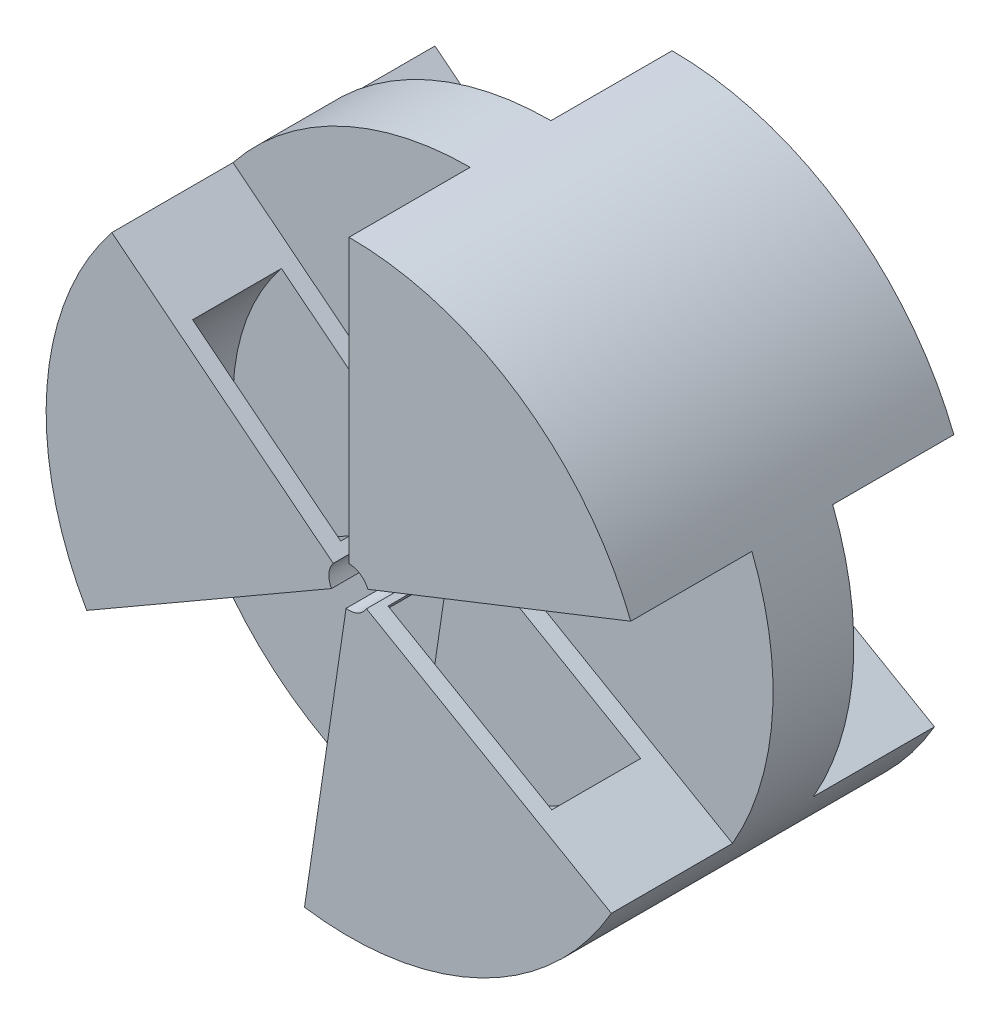
from build123d import *

# Parameters (mm, degrees)
ESQUISSE1_R        = 7.5
BOSS_EXTRU_1_DEPTH = 1
EXTRU_MINCE1_START = -3
EXTRU_MINCE1_DEPTH = 3
ESQUISSE2_W        = 4.681470229
ESQUISSE2_H        = 2.2


with BuildPart() as part:
    # Esquisse1 → Boss.-Extru.1 (new body)
    with BuildSketch(Plane.XY):
        Circle(ESQUISSE1_R)
    boss_extru_1 = extrude(amount=BOSS_EXTRU_1_DEPTH)

    # Esquisse1<3> → Extru.-Mince1 (add)
    with BuildSketch(Plane.XY.offset(EXTRU_MINCE1_START)):
        with BuildLine():
            ThreePointArc((0, 0.5), (0.28125, 0.413398642), (0.465073473, 0.18359375))
            Line((0.465073473, 0.18359375), (6.97610209, 2.75390625))
            ThreePointArc((6.97610209, 2.75390625), (4.21875, 6.200979635), (0, 7.5))
            Line((0, 7.5), (0, 0.5))
        make_face()
        with BuildLine():
            ThreePointArc((0.433012702, -0.25), (0.217388726, -0.450268966), (-0.073539885, -0.494562317))
            Line((-0.073539885, -0.494562317), (-1.103098273, -7.418434754))
            ThreePointArc((-1.103098273, -7.418434754), (3.260830893, -6.75403449), (6.495190528, -3.75))
            Line((6.495190528, -3.75), (0.433012702, -0.25))
        make_face()
        with BuildLine():
            ThreePointArc((-0.433012702, -0.25), (-0.498638726, 0.036870324), (-0.391533588, 0.310968567))
            Line((-0.391533588, 0.310968567), (-5.873003817, 4.664528504))
            ThreePointArc((-5.873003817, 4.664528504), (-7.479580893, 0.553054855), (-6.495190528, -3.75))
            Line((-6.495190528, -3.75), (-0.433012702, -0.25))
        make_face()
    extru_mince1 = extrude(amount=EXTRU_MINCE1_DEPTH)

    # Esquisse2 → Enlèvement de matière-Révolution1 (revolve, cut)
    with BuildSketch(Plane(origin=(0, 0, 0), x_dir=(1, 0, 0), z_dir=(0, 1, 0))):
        with Locations((-3.132268703, 1.5)):
            Rectangle(ESQUISSE2_W, ESQUISSE2_H)
    enl_vement_de_mati_re_r_volution1 = revolve(axis=Axis((-0.073539885, 0, -0.058266309), (0, 0, -1)), mode=Mode.SUBTRACT)

    # Symétrie1: Boss.-Extru.1, Extru.-Mince1, Enlèvement de matière-Révolution1 across plane
    add(boss_extru_1.mirror(Plane.XY.offset(1)))
    add(extru_mince1.mirror(Plane.XY.offset(1)))
    add(enl_vement_de_mati_re_r_volution1.mirror(Plane.XY.offset(1)), mode=Mode.SUBTRACT)


solid = part.part
